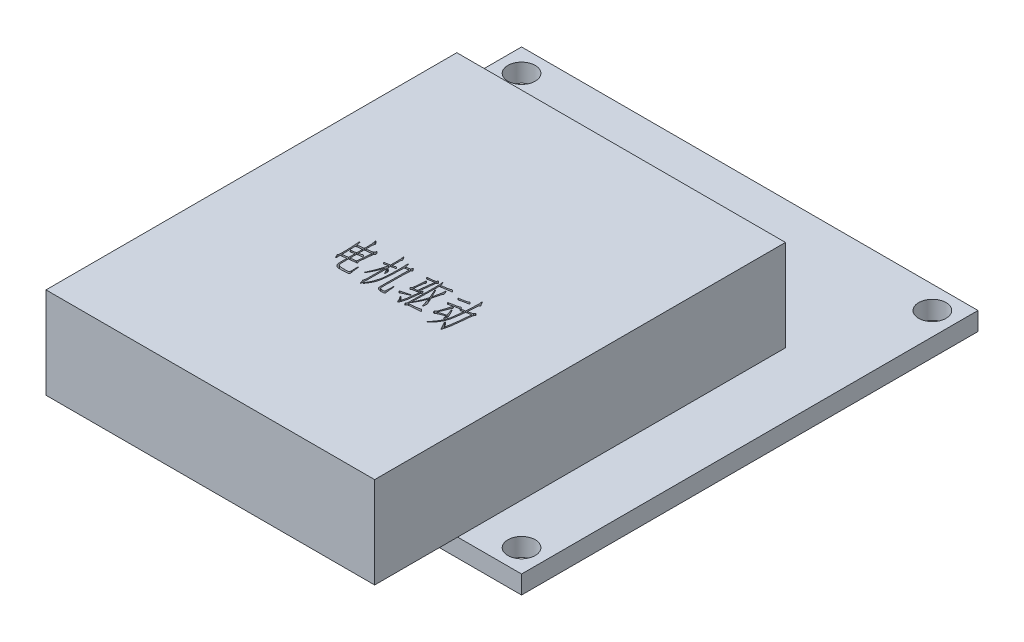
from build123d import *

# Parameters (mm, degrees)
SKETCH_1_W               = 50
SKETCH_1_H               = 50
EXTRUDE_1_DEPTH          = 2
SKETCH_2_R               = 1.5
CUT_EXTRUDE_1_DEPTH      = 36.411862419
MIRROR_2_COPY_1_SKETCH_R = 1.5
MIRROR_2_COPY_1_DEPTH    = 36.411862419
SKETCH_6_W               = 36
SKETCH_6_H               = 45
EXTRUDE_2_DEPTH          = 10
CUT_EXTRUDE_2_DEPTH      = 1


with BuildPart() as part:
    # 草图1 → 凸台-拉伸1 (new body)
    with BuildSketch(Plane(origin=(0, 0, 0), x_dir=(1, 0, 0), z_dir=(0, 1, 0))):
        Rectangle(SKETCH_1_W, SKETCH_1_H)
    extrude(amount=EXTRUDE_1_DEPTH)

    # 草图2 → 切除-拉伸1 (cut, through all)
    with BuildSketch(Plane(origin=(0, 2, 0), x_dir=(1, 0, 0), z_dir=(0, 1, 0))):
        with Locations(Location((-22.5, 22.5, 0), (0, 0, 270))):
            Circle(SKETCH_2_R)
    cut_extrude_1 = extrude(amount=-CUT_EXTRUDE_1_DEPTH, mode=Mode.SUBTRACT)

    # 镜向1: 切除-拉伸1 across plane
    add(cut_extrude_1.mirror(Plane(origin=(0, 0, 0), x_dir=(1, 0, 0), z_dir=(0, 0, -1))), mode=Mode.SUBTRACT)

    # 镜向2: 切除-拉伸1 across plane
    add(cut_extrude_1.mirror(Plane.ZY), mode=Mode.SUBTRACT)

    # 镜向2 copy 1 sketch → 镜向2 copy 1 (cut, through all)
    with BuildSketch(Plane(origin=(0, 2, 0), x_dir=(-1, 0, 0), z_dir=(0, 1, 0))):
        with Locations(Location((-22.5, 22.5, 0), (0, 0, 270))):
            Circle(MIRROR_2_COPY_1_SKETCH_R)
    extrude(amount=-MIRROR_2_COPY_1_DEPTH, mode=Mode.SUBTRACT)

    # 草图6 → 凸台-拉伸2 (add)
    with BuildSketch(Plane(origin=(0, 2, 0), x_dir=(1, 0, 0), z_dir=(0, 1, 0))):
        with Locations((0, -11.592181412)):
            Rectangle(SKETCH_6_W, SKETCH_6_H)
    extrude(amount=EXTRUDE_2_DEPTH)

    # 草图8 → 切除-拉伸2 (cut)
    # profile 1 of 8: a face of its own
    with BuildSketch(Plane(origin=(0, 12, 0), x_dir=(1, 0, 0), z_dir=(0, 1, 0))):
        with BuildLine():
            Line((-5.321410153, -12.334327445), (-5.255780492, -12.581184467))
            Line((-5.255780492, -12.581184467), (-5.200591913, -12.797464032))
            Line((-5.200591913, -12.797464032), (-5.009669262, -12.777327659))
            Line((-5.009669262, -12.777327659), (-4.606941796, -12.727359621))
            Line((-4.606941796, -12.727359621), (-4.501039388, -12.707223248))
            Line((-4.501039388, -12.707223248), (-4.495818847, -12.244086661))
            add(Edge.make_bspline(
                [(-4.495818847, -12.244086661), (-4.495796903, -12.240108766), (-4.49572831, -12.227674188), (-4.496900542, -12.202329396), (-4.497195093, -12.163532762), (-4.498981349, -12.112079423), (-4.500760435, -12.049387208), (-4.505478606, -11.977281925), (-4.512294709, -11.896734079), (-4.520841528, -11.809360911), (-4.532772756, -11.718038707), (-4.551420898, -11.626584389), (-4.576197761, -11.536498145), (-4.596664094, -11.477802544), (-4.606941796, -11.448327019)],
                knots=[0, 0, 0, 0, 0.177294891, 0.554209453, 1.130524385, 1.906506064, 2.848971625, 3.925876191, 5.126764862, 6.452083082, 7.83897123, 9.22979357, 10.608868701, 12, 12, 12, 12], degree=3))
            Line((-4.606941796, -11.448327019), (-4.561448508, -11.378222608))
            Line((-4.561448508, -11.378222608), (-4.259402908, -11.720540955))
            add(Edge.make_bspline(
                [(-4.259402908, -11.720540955), (-4.274604129, -11.755032933), (-4.304411059, -11.822665657), (-4.330859378, -11.913321098), (-4.343688812, -11.993948759), (-4.349637893, -12.069727322), (-4.354276507, -12.161495706), (-4.354657956, -12.228168285), (-4.354864233, -12.264223035)],
                knots=[0, 0, 0, 0, 1.215957117, 2.384278755, 3.034624226, 3.848266097, 4.836399765, 6, 6, 6, 6], degree=3))
            Line((-4.354864233, -12.264223035), (-4.354864233, -12.687086874))
            Line((-4.354864233, -12.687086874), (-4.108007212, -12.656509419))
            Line((-4.108007212, -12.656509419), (-3.72094137, -12.60132084))
            Line((-3.72094137, -12.60132084), (-3.624734253, -12.581184467))
            Line((-3.624734253, -12.581184467), (-3.53971401, -12.405177648))
            add(Edge.make_bspline(
                [(-3.53971401, -12.405177648), (-3.535956731, -12.396840672), (-3.529581456, -12.382694661), (-3.519121858, -12.366274684), (-3.512993854, -12.355066381), (-3.503878958, -12.350871862), (-3.495603174, -12.357146151), (-3.485215813, -12.365313769), (-3.470102925, -12.377866347), (-3.459773015, -12.388653619), (-3.453947975, -12.394736565)],
                knots=[0, 0, 0, 0, 1.663720426, 2.822966936, 3.56700533, 3.954602535, 4.461796658, 5.269494342, 6.4602669, 8, 8, 8, 8], degree=3))
            Line((-3.453947975, -12.394736565), (-3.333129735, -12.530470637))
            add(Edge.make_bspline(
                [(-3.333129735, -12.530470637), (-3.327388415, -12.538395529), (-3.316998733, -12.552736674), (-3.303506324, -12.572179731), (-3.297045347, -12.589439951), (-3.294909183, -12.6066701), (-3.29881186, -12.62314435), (-3.304391359, -12.638589405), (-3.314224578, -12.652404544), (-3.325998214, -12.67152188), (-3.343771975, -12.698973908), (-3.368199188, -12.733808825), (-3.392941987, -12.778842429), (-3.412430301, -12.835115817), (-3.428931241, -12.900722141), (-3.435533439, -12.948272485), (-3.439032143, -12.973470851)],
                knots=[0, 0, 0, 0, 0.847429402, 1.533536147, 2.036930199, 2.426382901, 3.016860564, 3.480069352, 3.837966044, 4.476237987, 5.424607541, 6.665143789, 8.156530738, 9.850434346, 11.801019622, 14, 14, 14, 14], degree=3))
            Line((-3.439032143, -12.973470851), (-3.494220722, -13.497016557))
            Line((-3.494220722, -13.497016557), (-3.559850383, -14.136905754))
            Line((-3.559850383, -14.136905754), (-3.579986756, -14.29799674))
            Line((-3.579986756, -14.29799674), (-3.483779639, -14.433730812))
            add(Edge.make_bspline(
                [(-3.483779639, -14.433730812), (-3.47723596, -14.445118634), (-3.466411258, -14.463956625), (-3.458797469, -14.490570206), (-3.46629652, -14.511585289), (-3.477933955, -14.513376533), (-3.483779639, -14.514276305)],
                knots=[0, 0, 0, 0, 1.606901506, 2.658172752, 3.325977029, 4, 4, 4, 4], degree=3))
            Line((-3.483779639, -14.514276305), (-3.564325133, -14.519496847))
            Line((-3.564325133, -14.519496847), (-4.007325346, -14.559769593))
            Line((-4.007325346, -14.559769593), (-4.259402908, -14.589601258))
            Line((-4.259402908, -14.589601258), (-4.365305316, -14.60451709))
            Line((-4.365305316, -14.60451709), (-4.365305316, -15.148199169))
            add(Edge.make_bspline(
                [(-4.365305316, -15.148199169), (-4.364374898, -15.203398108), (-4.362573971, -15.310241694), (-4.352645287, -15.440930317), (-4.336527188, -15.53740369), (-4.317567157, -15.601811104), (-4.289687683, -15.658019504), (-4.262256869, -15.702893671), (-4.22583098, -15.731868398), (-4.184462117, -15.749365796), (-4.129863102, -15.764824666), (-4.061109325, -15.77680867), (-3.978187121, -15.786271306), (-3.881355972, -15.792409436), (-3.770458369, -15.797149055), (-3.691861932, -15.797563432), (-3.650091167, -15.797783657)],
                knots=[0, 0, 0, 0, 1.931152807, 3.737957541, 4.577172512, 5.350113142, 6.073531508, 6.773090527, 7.162848559, 7.680298175, 8.332476513, 9.14602524, 10.117846342, 11.250994603, 12.539017008, 14, 14, 14, 14], degree=3))
            add(Edge.make_bspline(
                [(-3.650091167, -15.797783657), (-3.611060719, -15.79793522), (-3.537715147, -15.798220037), (-3.43499322, -15.79636997), (-3.346894327, -15.791275449), (-3.273545692, -15.78394411), (-3.214258877, -15.775275549), (-3.170222557, -15.762739196), (-3.137887349, -15.749482276), (-3.109083544, -15.712100241), (-3.096211733, -15.648600227), (-3.089605012, -15.594084763), (-3.086272714, -15.566588259)],
                knots=[0, 0, 0, 0, 1.652015129, 3.104447941, 4.3482727, 5.384821521, 6.227270062, 6.873348196, 7.334536251, 7.663266203, 8.821398446, 10, 10, 10, 10], degree=3))
            Line((-3.086272714, -15.566588259), (-3.086272714, -15.289153783))
            Line((-3.086272714, -15.289153783), (-3.086272714, -14.851374111))
            Line((-3.086272714, -14.851374111), (-3.025863594, -14.84167882))
            Line((-3.025863594, -14.84167882), (-3.016168303, -14.96249706))
            Line((-3.016168303, -14.96249706), (-2.990811389, -15.168335543))
            Line((-2.990811389, -15.168335543), (-2.955759183, -15.440549478))
            Line((-2.955759183, -15.440549478), (-2.919961186, -15.671744876))
            Line((-2.919961186, -15.671744876), (-2.895350063, -15.838056404))
            add(Edge.make_bspline(
                [(-2.895350063, -15.838056404), (-2.892722166, -15.852044917), (-2.888497794, -15.874531599), (-2.886993069, -15.904569765), (-2.900028918, -15.924424799), (-2.912739462, -15.93022324), (-2.919961186, -15.933517729)],
                knots=[0, 0, 0, 0, 1.559608042, 2.507086382, 3.151774227, 4, 4, 4, 4], degree=3))
            Line((-2.919961186, -15.933517729), (-2.960233933, -15.949179353))
            add(Edge.make_bspline(
                [(-2.960233933, -15.949179353), (-2.964924906, -15.951022164), (-2.976077787, -15.955403485), (-2.996506676, -15.960013957), (-3.022475023, -15.966317653), (-3.054702471, -15.971816832), (-3.092633808, -15.978877556), (-3.136508261, -15.985109763), (-3.186128102, -15.993000696), (-3.296984019, -16.007432576), (-3.463935903, -16.024270861), (-3.612753603, -16.024427911), (-3.685143373, -16.024504305)],
                knots=[0, 0, 0, 0, 0.206618915, 0.491240576, 0.857597671, 1.30390666, 1.832361082, 2.441372039, 3.122534554, 3.89462094, 7.030145068, 10, 10, 10, 10], degree=3))
            add(Edge.make_bspline(
                [(-3.685143373, -16.024504305), (-3.725172175, -16.024250371), (-3.801031435, -16.023769137), (-3.908490442, -16.019371753), (-4.0035546, -16.012147867), (-4.086481247, -16.001976443), (-4.157613121, -15.988929884), (-4.216643226, -15.97292479), (-4.264030664, -15.954477185), (-4.308564847, -15.924139234), (-4.349460168, -15.882669404), (-4.391231289, -15.834267524), (-4.424100492, -15.785767443), (-4.454845445, -15.717779188), (-4.478349949, -15.623181951), (-4.498078115, -15.499372006), (-4.508594065, -15.3626664), (-4.510008226, -15.267788175), (-4.510734679, -15.219049372)],
                knots=[0, 0, 0, 0, 1.375107078, 2.605988713, 3.693973982, 4.649466436, 5.475237603, 6.17560074, 6.749778481, 7.211670088, 8.015056038, 8.742243092, 9.407844955, 10.019243034, 11.295622579, 12.740386124, 14.325541172, 16, 16, 16, 16], degree=3))
            Line((-4.510734679, -15.219049372), (-4.510734679, -14.624653463))
            Line((-4.510734679, -14.624653463), (-4.662130375, -14.640315087))
            Line((-4.662130375, -14.640315087), (-5.024585094, -14.695503665))
            Line((-5.024585094, -14.695503665), (-5.155098625, -14.715640039))
            Line((-5.155098625, -14.715640039), (-5.160319166, -14.942360686))
            Line((-5.160319166, -14.942360686), (-5.165539708, -15.072874217))
            add(Edge.make_bspline(
                [(-5.165539708, -15.072874217), (-5.166270538, -15.092510449), (-5.167666987, -15.130030809), (-5.179024336, -15.167510988), (-5.189353525, -15.199324625), (-5.21002754, -15.195417564), (-5.222118977, -15.173064914), (-5.230412098, -15.155074397), (-5.235644118, -15.14372442)],
                knots=[0, 0, 0, 0, 1.721263003, 3.288940973, 3.839377096, 4.198736227, 4.863606649, 6, 6, 6, 6], degree=3))
            Line((-5.235644118, -15.14372442), (-5.311714862, -14.972192351))
            Line((-5.311714862, -14.972192351), (-5.3616829, -14.861815193))
            add(Edge.make_bspline(
                [(-5.3616829, -14.861815193), (-5.366586864, -14.850448101), (-5.37437425, -14.832397413), (-5.386870516, -14.809609782), (-5.381553267, -14.789074884), (-5.374181548, -14.764273197), (-5.359455324, -14.728404529), (-5.348009196, -14.700703201), (-5.341546526, -14.685062583)],
                knots=[0, 0, 0, 0, 1.195724136, 1.898783123, 2.330290027, 3.145663464, 4.388395428, 6, 6, 6, 6], degree=3))
            add(Edge.make_bspline(
                [(-5.341546526, -14.685062583), (-5.337529824, -14.67571121), (-5.328958458, -14.655756024), (-5.321412175, -14.621187715), (-5.315104143, -14.581376491), (-5.313519352, -14.521712907), (-5.311816917, -14.448655188), (-5.30988406, -14.368832818), (-5.307131625, -14.304724576), (-5.306679408, -14.267669608), (-5.306494321, -14.252503452)],
                knots=[0, 0, 0, 0, 0.558699634, 1.192226558, 1.938775613, 2.774002823, 4.470288396, 5.961506424, 7.165668957, 8, 8, 8, 8], degree=3))
            Line((-5.306494321, -14.252503452), (-5.311714862, -13.8751329))
            Line((-5.311714862, -13.8751329), (-5.326630694, -13.401555232))
            add(Edge.make_bspline(
                [(-5.326630694, -13.401555232), (-5.326586994, -13.3955882), (-5.326483178, -13.381412732), (-5.32756563, -13.357309249), (-5.328015273, -13.32721381), (-5.329635225, -13.291414536), (-5.332063327, -13.249424797), (-5.334217736, -13.201439833), (-5.336280118, -13.147475589), (-5.340311654, -13.07092063), (-5.345001615, -12.97993476), (-5.349741709, -12.882686368), (-5.355507094, -12.804941924), (-5.359109986, -12.739229704), (-5.365472687, -12.672175031), (-5.37234789, -12.589537284), (-5.384374429, -12.484760707), (-5.392350137, -12.407423921), (-5.396735105, -12.364904901)],
                knots=[0, 0, 0, 0, 0.275532466, 0.654563513, 1.113927774, 1.665470852, 2.30930182, 3.056329963, 3.883644582, 4.803233469, 6.596547928, 8.091177521, 9.299307877, 10.196626331, 11.130014446, 12.409513054, 14.025984863, 16, 16, 16, 16], degree=3))
            Line((-5.396735105, -12.364904901), (-5.321410153, -12.334327445))
        make_face()
        with BuildLine():
            Line((-5.155098625, -14.509055764), (-4.510734679, -14.433730812))
            Line((-4.510734679, -14.433730812), (-4.506259929, -13.734178287))
            Line((-4.506259929, -13.734178287), (-4.641994001, -13.764009951))
            Line((-4.641994001, -13.764009951), (-4.797864447, -13.804282698))
            Line((-4.797864447, -13.804282698), (-4.93881906, -13.854996527))
            Line((-4.93881906, -13.854996527), (-4.973871265, -13.804282698))
            Line((-4.973871265, -13.804282698), (-5.0596373, -13.693905541))
            add(Edge.make_bspline(
                [(-5.0596373, -13.693905541), (-5.064878313, -13.68811985), (-5.073884939, -13.6781772), (-5.079991984, -13.659186487), (-5.070697443, -13.643218857), (-5.060059415, -13.639789945), (-5.054416758, -13.63797117)],
                knots=[0, 0, 0, 0, 1.284117706, 2.206742812, 3.048814964, 4, 4, 4, 4], degree=3))
            Line((-5.054416758, -13.63797117), (-4.87840994, -13.613360047))
            Line((-4.87840994, -13.613360047), (-4.671825665, -13.588003133))
            Line((-4.671825665, -13.588003133), (-4.506259929, -13.557425677))
            Line((-4.506259929, -13.557425677), (-4.501039388, -12.90336644))
            Line((-4.501039388, -12.90336644), (-4.651689292, -12.928723354))
            Line((-4.651689292, -12.928723354), (-4.989532889, -12.973470851))
            Line((-4.989532889, -12.973470851), (-5.195371372, -13.009268848))
            Line((-5.195371372, -13.009268848), (-5.185676081, -13.401555232))
            Line((-5.185676081, -13.401555232), (-5.155098625, -14.509055764))
        make_face(mode=Mode.SUBTRACT)
        with BuildLine():
            Line((-4.365305316, -14.413594439), (-4.002850596, -14.373321692))
            Line((-4.002850596, -14.373321692), (-3.831318527, -14.342744236))
            Line((-3.831318527, -14.342744236), (-3.73063666, -14.322607863))
            Line((-3.73063666, -14.322607863), (-3.705279746, -14.080971383))
            Line((-3.705279746, -14.080971383), (-3.665006999, -13.673769167))
            Line((-3.665006999, -13.673769167), (-3.615038962, -13.059236885))
            Line((-3.615038962, -13.059236885), (-3.589682047, -12.792243491))
            Line((-3.589682047, -12.792243491), (-3.826097986, -12.817600405))
            Line((-3.826097986, -12.817600405), (-4.360084775, -12.888450608))
            Line((-4.360084775, -12.888450608), (-4.365305316, -13.527594013))
            add(Edge.make_bspline(
                [(-4.365305316, -13.527594013), (-4.317432654, -13.516173791), (-4.228388545, -13.494931949), (-4.106876802, -13.458076835), (-4.005804215, -13.423224044), (-3.948181529, -13.394374311), (-3.922305103, -13.381418858)],
                knots=[0, 0, 0, 0, 1.262396956, 2.348083582, 3.25817942, 4, 4, 4, 4], degree=3))
            Line((-3.922305103, -13.381418858), (-3.785825239, -13.547730386))
            add(Edge.make_bspline(
                [(-3.785825239, -13.547730386), (-3.779232862, -13.558053053), (-3.767886654, -13.575819501), (-3.760425671, -13.602950003), (-3.770160326, -13.625628999), (-3.783854301, -13.62736448), (-3.79104578, -13.628275879)],
                knots=[0, 0, 0, 0, 1.442479735, 2.482666664, 3.203162602, 4, 4, 4, 4], degree=3))
            Line((-3.79104578, -13.628275879), (-3.861895983, -13.633496421))
            Line((-3.861895983, -13.633496421), (-4.027461719, -13.653632794))
            Line((-4.027461719, -13.653632794), (-4.188552706, -13.673769167))
            Line((-4.188552706, -13.673769167), (-4.365305316, -13.708821373))
            Line((-4.365305316, -13.708821373), (-4.365305316, -14.413594439))
        make_face(mode=Mode.SUBTRACT)
    # profile 2 of 8: a face of its own
    with BuildSketch(Plane(origin=(0, 12, 0), x_dir=(1, 0, 0), z_dir=(0, 1, 0))):
        with BuildLine():
            Line((-1.306068154, -16.054335969), (-1.261320658, -15.979011017))
            Line((-1.261320658, -15.979011017), (-1.195690997, -15.87832915))
            add(Edge.make_bspline(
                [(-1.195690997, -15.87832915), (-1.184621914, -15.860757327), (-1.159663628, -15.82113683), (-1.121315998, -15.752970845), (-1.07659256, -15.670292199), (-1.02676493, -15.573226967), (-0.974440962, -15.462091515), (-0.924448316, -15.337176124), (-0.875740607, -15.199825663), (-0.83020517, -15.053091676), (-0.787841914, -14.903659328), (-0.750809474, -14.758071145), (-0.721711649, -14.619185541), (-0.691612297, -14.440897641), (-0.66535467, -14.215536467), (-0.648525053, -13.988672438), (-0.640439268, -13.809745838), (-0.634222159, -13.688952111), (-0.629600802, -13.583050843), (-0.627586301, -13.517652271), (-0.626652002, -13.487321266)],
                knots=[0, 0, 0, 0, 0.450396065, 1.015541542, 1.69591192, 2.489306403, 3.381862471, 4.359132752, 5.406289086, 6.54209713, 7.690873604, 8.775026693, 9.799772289, 10.767790753, 12.695987523, 14.718287292, 15.700853826, 16.580828697, 17.341806847, 18, 18, 18, 18], degree=3))
            Line((-0.626652002, -13.487321266), (-0.621431461, -13.09428909))
            add(Edge.make_bspline(
                [(-0.621431461, -13.09428909), (-0.620621398, -13.05849225), (-0.619074475, -12.9901335), (-0.617868642, -12.892425292), (-0.616129096, -12.804181332), (-0.615293144, -12.725372159), (-0.615577689, -12.6557641), (-0.615216225, -12.595599663), (-0.616154697, -12.544887981), (-0.616708893, -12.514311718), (-0.616956712, -12.500638973)],
                knots=[0, 0, 0, 0, 1.447396349, 2.76399273, 3.949966632, 5.015227426, 5.949801441, 6.763785261, 7.447203589, 8, 8, 8, 8], degree=3))
            Line((-0.616956712, -12.500638973), (-0.641567835, -11.785424825))
            Line((-0.641567835, -11.785424825), (-0.576683965, -11.775729534))
            Line((-0.576683965, -11.775729534), (-0.465561016, -12.228425038))
            Line((-0.465561016, -12.228425038), (-0.194092872, -12.183677541))
            Line((-0.194092872, -12.183677541), (-0.017340262, -12.143404795))
            Line((-0.017340262, -12.143404795), (0.05798469, -11.992009099))
            add(Edge.make_bspline(
                [(0.05798469, -11.992009099), (0.063298397, -11.98199485), (0.072481124, -11.964689017), (0.083080752, -11.940688002), (0.091196213, -11.929522977), (0.094395741, -11.91785689), (0.103055291, -11.924118323), (0.110058234, -11.934836684), (0.125918376, -11.953354954), (0.137204987, -11.968379621), (0.143750725, -11.977093267)],
                knots=[0, 0, 0, 0, 1.750642571, 3.025322233, 3.841294237, 4.147689096, 4.402625028, 5.10337688, 6.320085901, 8, 8, 8, 8], degree=3))
            Line((0.143750725, -11.977093267), (0.259348424, -12.147879544))
            Line((0.259348424, -12.147879544), (0.294400629, -12.198593373))
            add(Edge.make_bspline(
                [(0.294400629, -12.198593373), (0.293574976, -12.201657379), (0.291535165, -12.20922714), (0.282109637, -12.220416748), (0.267615088, -12.233748582), (0.25570651, -12.243177816), (0.248907341, -12.248561411)],
                knots=[0, 0, 0, 0, 0.548465928, 1.355009271, 2.489850087, 4, 4, 4, 4], degree=3))
            add(Edge.make_bspline(
                [(0.248907341, -12.248561411), (0.240375263, -12.256719069), (0.223003126, -12.27332885), (0.202476091, -12.304647821), (0.188760255, -12.341674939), (0.179328575, -12.386627465), (0.174413718, -12.445410227), (0.168212174, -12.52443608), (0.162515777, -12.62663862), (0.158218938, -12.728826206), (0.155399799, -12.829526405), (0.153459422, -12.927983529), (0.149968658, -13.046294309), (0.148185735, -13.184778598), (0.145781328, -13.342883262), (0.143870953, -13.521135587), (0.140370039, -13.719005603), (0.139162216, -13.85772963), (0.138530184, -13.930321479)],
                knots=[0, 0, 0, 0, 0.332112915, 0.676214057, 1.044588446, 1.439171756, 1.967855015, 2.705969595, 3.674883544, 4.853475679, 5.589757507, 6.515230302, 7.630069172, 8.926968948, 10.420108045, 12.088465276, 13.953162509, 16, 16, 16, 16], degree=3))
            Line((0.138530184, -13.930321479), (0.133309643, -14.468783018))
            add(Edge.make_bspline(
                [(0.133309643, -14.468783018), (0.132495333, -14.508308905), (0.130917996, -14.584871519), (0.129748132, -14.696003082), (0.127897028, -14.799412384), (0.127464105, -14.89562557), (0.126460359, -14.984371268), (0.126414941, -15.065916098), (0.127330389, -15.1397471), (0.127845326, -15.186483118), (0.128089101, -15.208608289)],
                knots=[0, 0, 0, 0, 1.282389524, 2.484020003, 3.605019191, 4.637230873, 5.604933393, 6.48389933, 7.282266915, 8, 8, 8, 8], degree=3))
            add(Edge.make_bspline(
                [(0.128089101, -15.208608289), (0.128341894, -15.238934997), (0.128847504, -15.299591467), (0.129510158, -15.387917201), (0.134166367, -15.468519654), (0.139079511, -15.528995981), (0.150530772, -15.571073822), (0.168094523, -15.597976125), (0.192697442, -15.621951945), (0.224780326, -15.644336306), (0.267306874, -15.661742111), (0.319976656, -15.676734698), (0.38412373, -15.686391118), (0.430605796, -15.689966853), (0.455491616, -15.691881249)],
                knots=[0, 0, 0, 0, 1.548227621, 3.096611253, 4.507253594, 5.670446461, 6.188252976, 6.712856766, 7.287138982, 7.934824603, 8.696328188, 9.620171516, 10.725874525, 12, 12, 12, 12], degree=3))
            add(Edge.make_bspline(
                [(0.455491616, -15.691881249), (0.482344028, -15.694324692), (0.529778126, -15.698640972), (0.591365258, -15.698718962), (0.636047874, -15.692901979), (0.671108378, -15.667929421), (0.68476983, -15.617461485), (0.689351808, -15.57810149), (0.691907554, -15.556147177)],
                knots=[0, 0, 0, 0, 1.45354194, 2.56764457, 3.336336834, 3.835662206, 4.792770472, 6, 6, 6, 6], degree=3))
            Line((0.691907554, -15.556147177), (0.702348637, -15.294374324))
            Line((0.702348637, -15.294374324), (0.717264469, -14.821542447))
            Line((0.717264469, -14.821542447), (0.72248501, -14.730555871))
            Line((0.72248501, -14.730555871), (0.777673589, -14.730555871))
            Line((0.777673589, -14.730555871), (0.788114671, -14.831237737))
            Line((0.788114671, -14.831237737), (0.808251045, -15.087790049))
            Line((0.808251045, -15.087790049), (0.84330325, -15.3853609))
            Line((0.84330325, -15.3853609), (0.878355455, -15.651608502))
            add(Edge.make_bspline(
                [(0.878355455, -15.651608502), (0.880505955, -15.670076121), (0.884458869, -15.704022148), (0.894346054, -15.748691929), (0.906031932, -15.781913419), (0.904351375, -15.800976362), (0.90371237, -15.808224739)],
                knots=[0, 0, 0, 0, 1.398542196, 2.570713209, 3.45653668, 4, 4, 4, 4], degree=3))
            add(Edge.make_bspline(
                [(0.90371237, -15.808224739), (0.899739346, -15.816300866), (0.891125867, -15.833809835), (0.864861517, -15.854397316), (0.828054818, -15.868816121), (0.78105477, -15.881681882), (0.722970036, -15.889836335), (0.653724302, -15.89487112), (0.573556886, -15.896161717), (0.516392769, -15.894255937), (0.486069071, -15.893244982)],
                knots=[0, 0, 0, 0, 0.481460529, 1.043801962, 1.747490212, 2.610949425, 3.670894661, 4.910120447, 6.36091974, 8, 8, 8, 8], degree=3))
            add(Edge.make_bspline(
                [(0.486069071, -15.893244982), (0.453957761, -15.891576926), (0.392412262, -15.888379879), (0.304115579, -15.874688367), (0.225024233, -15.851125727), (0.153504745, -15.822030111), (0.093897093, -15.779352584), (0.046361117, -15.72502028), (0.015148903, -15.65708104), (-0.007479577, -15.553651393), (-0.017984397, -15.419665296), (-0.017551981, -15.312024866), (-0.017340262, -15.259322118)],
                knots=[0, 0, 0, 0, 1.004787696, 1.925806212, 2.783943376, 3.580792567, 4.326890195, 5.054220735, 5.811881477, 6.635445581, 8.352651878, 10, 10, 10, 10], degree=3))
            Line((-0.017340262, -15.259322118), (-0.012865512, -14.594821799))
            Line((-0.012865512, -14.594821799), (0.012491403, -12.319411613))
            Line((0.012491403, -12.319411613), (-0.455865725, -12.405177648))
            add(Edge.make_bspline(
                [(-0.455865725, -12.405177648), (-0.457327468, -12.428547187), (-0.460048633, -12.472051662), (-0.464256767, -12.532423601), (-0.465866336, -12.582946503), (-0.46887605, -12.627894082), (-0.470233762, -12.676393535), (-0.471577952, -12.738053694), (-0.474068496, -12.817344307), (-0.476863547, -12.950105806), (-0.481034707, -13.13682425), (-0.487359962, -13.33494264), (-0.493334226, -13.50696189), (-0.498030106, -13.650199375), (-0.506349976, -13.805263492), (-0.512043761, -13.942572958), (-0.519921273, -14.060151342), (-0.527958148, -14.156417973), (-0.539520656, -14.259288461), (-0.5527335, -14.36898754), (-0.569161354, -14.485102422), (-0.588927419, -14.607820526), (-0.610462652, -14.737400395), (-0.634187912, -14.873322574), (-0.664911109, -15.013680227), (-0.706823327, -15.156273858), (-0.760244918, -15.300617266), (-0.824426777, -15.446837291), (-0.900192707, -15.594425557), (-0.986067979, -15.743901348), (-1.083318693, -15.894700771), (-1.154256665, -15.993965894), (-1.190470455, -16.044640678)],
                knots=[0, 0, 0, 0, 0.556766377, 1.036470108, 1.438810268, 1.75849741, 2.107447749, 2.592295321, 3.225022722, 3.993659562, 5.749719254, 7.665800851, 8.706744263, 9.842413613, 11.073325319, 12.398988745, 13.10988535, 13.875173787, 14.695698795, 15.571108291, 16.502351507, 17.483865213, 18.526569343, 19.625732515, 20.764397609, 21.940927665, 23.156500752, 24.421679417, 25.735535166, 27.099239022, 28.519163328, 30, 30, 30, 30], degree=3))
            Line((-1.190470455, -16.044640678), (-1.256100117, -16.134881462))
            Line((-1.256100117, -16.134881462), (-1.306068154, -16.054335969))
        make_face()
    # profile 3 of 8: a face of its own
    with BuildSketch(Plane(origin=(0, 12, 0), x_dir=(1, 0, 0), z_dir=(0, 1, 0))):
        with BuildLine():
            Line((-2.222646036, -14.972192351), (-2.182373289, -14.891646857))
            add(Edge.make_bspline(
                [(-2.182373289, -14.891646857), (-2.167972688, -14.861060794), (-2.140450886, -14.802606044), (-2.100849976, -14.719230376), (-2.065489883, -14.643793665), (-2.035419575, -14.576078811), (-2.008231075, -14.516819329), (-1.984938875, -14.465541949), (-1.966490525, -14.421941613), (-1.951085618, -14.383551441), (-1.935911447, -14.345614443), (-1.919772982, -14.302159066), (-1.900016032, -14.251429211), (-1.878505316, -14.192461149), (-1.854927637, -14.125397035), (-1.827863697, -14.050646013), (-1.798112591, -13.968171829), (-1.754528091, -13.846070701), (-1.699865958, -13.683381839), (-1.640023588, -13.477935223), (-1.582837192, -13.262488536), (-1.549691817, -13.114546116), (-1.532788802, -13.039100512)],
                knots=[0, 0, 0, 0, 1.030703704, 1.969836002, 2.814173433, 3.570663832, 4.228669159, 4.801998382, 5.287666534, 5.671901349, 6.063173338, 6.53333551, 7.085118219, 7.722952876, 8.446926576, 9.252476561, 10.14673978, 11.120025788, 13.205233894, 15.378080529, 17.642978206, 20, 20, 20, 20], degree=3))
            add(Edge.make_bspline(
                [(-1.532788802, -13.039100512), (-1.558654603, -13.044765911), (-1.608200916, -13.055618065), (-1.679060715, -13.072005005), (-1.743436742, -13.087732657), (-1.801389938, -13.102541301), (-1.85292919, -13.116493028), (-1.897701369, -13.130406653), (-1.93667686, -13.14154418), (-1.959930213, -13.150569283), (-1.970568474, -13.15469821)],
                knots=[0, 0, 0, 0, 1.402469967, 2.686451399, 3.852096233, 4.91235732, 5.854704873, 6.679518484, 7.395888129, 8, 8, 8, 8], degree=3))
            Line((-1.970568474, -13.15469821), (-2.101827796, -13.02418468))
            add(Edge.make_bspline(
                [(-2.101827796, -13.02418468), (-2.108423087, -13.018410877), (-2.119515897, -13.008699752), (-2.131207043, -12.992929431), (-2.127516861, -12.979927346), (-2.11672265, -12.973886004), (-2.101578478, -12.967887934), (-2.088997349, -12.965286326), (-2.081691423, -12.96377556)],
                knots=[0, 0, 0, 0, 1.574165917, 2.647635009, 3.103278432, 3.757919303, 4.698012364, 6, 6, 6, 6], degree=3))
            Line((-2.081691423, -12.96377556), (-1.840054943, -12.928723354))
            Line((-1.840054943, -12.928723354), (-1.643911751, -12.892925357))
            Line((-1.643911751, -12.892925357), (-1.487295514, -12.868314234))
            Line((-1.487295514, -12.868314234), (-1.487295514, -12.123268421))
            add(Edge.make_bspline(
                [(-1.487295514, -12.123268421), (-1.487423465, -12.081254906), (-1.487658948, -12.003932835), (-1.489717732, -11.895012236), (-1.494168781, -11.796748205), (-1.500751872, -11.71637328), (-1.510225491, -11.646683747), (-1.518470151, -11.583298952), (-1.53293368, -11.509503041), (-1.542554467, -11.456541722), (-1.547704634, -11.428190646)],
                knots=[0, 0, 0, 0, 1.441980529, 2.65383462, 3.73864278, 4.817799107, 5.419974992, 6.152410461, 7.010954554, 8, 8, 8, 8], degree=3))
            Line((-1.547704634, -11.428190646), (-1.502957138, -11.387917899))
            Line((-1.502957138, -11.387917899), (-1.271015949, -11.720540955))
            add(Edge.make_bspline(
                [(-1.271015949, -11.720540955), (-1.280399092, -11.740838512), (-1.297937176, -11.778776785), (-1.320893244, -11.83595761), (-1.336096742, -11.898046385), (-1.341529416, -11.956833493), (-1.34461842, -12.012858013), (-1.344493558, -12.063618748), (-1.34690006, -12.121264593), (-1.346534693, -12.162046606), (-1.346340901, -12.183677541)],
                knots=[0, 0, 0, 0, 1.129488372, 2.111132768, 3.106887357, 4.345033186, 5.086752704, 5.94060522, 6.907689153, 8, 8, 8, 8], degree=3))
            Line((-1.346340901, -12.183677541), (-1.351561442, -12.837736779))
            add(Edge.make_bspline(
                [(-1.351561442, -12.837736779), (-1.317904949, -12.829128909), (-1.251871441, -12.812240405), (-1.155979157, -12.781470312), (-1.065358837, -12.746784571), (-1.00761995, -12.720207541), (-0.979411431, -12.707223248)],
                knots=[0, 0, 0, 0, 1.054966239, 2.069827124, 3.057007872, 4, 4, 4, 4], degree=3))
            Line((-0.979411431, -12.707223248), (-0.848152109, -12.852652611))
            add(Edge.make_bspline(
                [(-0.848152109, -12.852652611), (-0.842488388, -12.862191268), (-0.833744009, -12.876918271), (-0.817939345, -12.894234357), (-0.823071756, -12.905124416), (-0.833590951, -12.907696945), (-0.848275628, -12.911756914), (-0.860985665, -12.912585595), (-0.868288482, -12.913061731)],
                knots=[0, 0, 0, 0, 1.981905509, 3.059919989, 3.343564363, 3.854474294, 4.767243278, 6, 6, 6, 6], degree=3))
            Line((-0.868288482, -12.913061731), (-1.144977168, -12.96377556))
            Line((-1.144977168, -12.96377556), (-1.346340901, -13.004048306))
            Line((-1.346340901, -13.004048306), (-1.346340901, -13.260600618))
            Line((-1.346340901, -13.260600618), (-1.205386288, -13.39633469))
            Line((-1.205386288, -13.39633469), (-1.100229671, -13.497016557))
            Line((-1.100229671, -13.497016557), (-1.019684178, -13.57756205))
            add(Edge.make_bspline(
                [(-1.019684178, -13.57756205), (-1.008878107, -13.588570291), (-0.991615839, -13.606155519), (-0.974466747, -13.630876235), (-0.970452923, -13.652039775), (-0.96887464, -13.674763183), (-0.965362662, -13.706274478), (-0.964326135, -13.730438144), (-0.963749808, -13.743873578)],
                knots=[0, 0, 0, 0, 1.523204729, 2.433259024, 2.884160726, 3.621426984, 4.677470549, 6, 6, 6, 6], degree=3))
            Line((-0.963749808, -13.743873578), (-0.97419089, -13.965373685))
            add(Edge.make_bspline(
                [(-0.97419089, -13.965373685), (-0.974434993, -13.974311421), (-0.974869363, -13.990215753), (-0.975499897, -14.011384028), (-0.979257052, -14.026142276), (-0.983629098, -14.037228876), (-0.996157732, -14.042599879), (-1.00120087, -14.035163867), (-1.004022554, -14.031003346)],
                knots=[0, 0, 0, 0, 1.677002643, 2.984156978, 3.944128222, 4.527591577, 5.176173178, 6, 6, 6, 6], degree=3))
            Line((-1.004022554, -14.031003346), (-1.044295301, -13.950457852))
            Line((-1.044295301, -13.950457852), (-1.104704421, -13.829639613))
            add(Edge.make_bspline(
                [(-1.104704421, -13.829639613), (-1.125565544, -13.791096377), (-1.166286867, -13.715859223), (-1.226500688, -13.60544008), (-1.286995804, -13.50173606), (-1.326914825, -13.434348511), (-1.346340901, -13.401555232)],
                knots=[0, 0, 0, 0, 1.069763083, 2.088198605, 3.069646585, 4, 4, 4, 4], degree=3))
            Line((-1.346340901, -13.401555232), (-1.356781983, -15.631472129))
            Line((-1.356781983, -15.631472129), (-1.366477274, -16.039420137))
            add(Edge.make_bspline(
                [(-1.366477274, -16.039420137), (-1.367690803, -16.066843354), (-1.369791408, -16.114312608), (-1.372830067, -16.177268665), (-1.37993124, -16.213945259), (-1.384617106, -16.24168989), (-1.403286789, -16.242997317), (-1.41350188, -16.223401), (-1.429093237, -16.198199415), (-1.437555925, -16.174322964), (-1.442548018, -16.160238377)],
                knots=[0, 0, 0, 0, 2.16266419, 3.743545244, 4.80908418, 5.322941257, 5.576717178, 6.045465741, 6.847030983, 8, 8, 8, 8], degree=3))
            Line((-1.442548018, -16.160238377), (-1.538009343, -15.918601897))
            add(Edge.make_bspline(
                [(-1.538009343, -15.918601897), (-1.543422892, -15.905002246), (-1.552994729, -15.880956353), (-1.563163294, -15.848554378), (-1.57031689, -15.82569773), (-1.574804742, -15.804088614), (-1.565996166, -15.777442739), (-1.55024214, -15.743956511), (-1.530793393, -15.707082288), (-1.518339703, -15.66470369), (-1.512172842, -15.612972172), (-1.508093112, -15.549199178), (-1.5035566, -15.480774276), (-1.499545137, -15.435571794), (-1.497736597, -15.415192564)],
                knots=[0, 0, 0, 0, 1.012562945, 1.790338711, 2.345528679, 2.676361519, 3.293857606, 4.217663353, 5.263990019, 6.161813593, 7.256362729, 8.860411071, 10.584537758, 12, 12, 12, 12], degree=3))
            Line((-1.497736597, -15.415192564), (-1.487295514, -13.472405434))
            add(Edge.make_bspline(
                [(-1.487295514, -13.472405434), (-1.517368035, -13.565051917), (-1.575362317, -13.743718891), (-1.667200814, -13.998890479), (-1.761926954, -14.230464084), (-1.843260176, -14.407476642), (-1.908172218, -14.535031282), (-1.950128062, -14.620966058), (-1.99105259, -14.697060562), (-2.026040211, -14.766123553), (-2.059556062, -14.825386812), (-2.087302313, -14.877610881), (-2.113397897, -14.920214417), (-2.129645294, -14.945857888), (-2.136880002, -14.957276519)],
                knots=[0, 0, 0, 0, 2.158156981, 4.16196457, 6.007247646, 7.700356929, 8.476310978, 9.178364641, 9.818953069, 10.390534321, 10.893443202, 11.327334904, 11.700472905, 12, 12, 12, 12], degree=3))
            Line((-2.136880002, -14.957276519), (-2.171932207, -15.017685639))
            Line((-2.171932207, -15.017685639), (-2.222646036, -14.972192351))
        make_face()
    # profile 4 of 8: a face of its own
    with BuildSketch(Plane(origin=(0, 12, 0), x_dir=(1, 0, 0), z_dir=(0, 1, 0))):
        with BuildLine():
            Line((3.070982773, -12.767632368), (3.070982773, -12.449925144))
            add(Edge.make_bspline(
                [(3.070982773, -12.449925144), (3.070135316, -12.416864257), (3.068580649, -12.356213739), (3.067866165, -12.274143251), (3.064970139, -12.209293795), (3.063887128, -12.157548645), (3.061005448, -12.11009671), (3.05879341, -12.058763822), (3.051753338, -11.999495629), (3.043662462, -11.912682211), (3.03289514, -11.808548819), (3.024725821, -11.727006029), (3.021014735, -11.689963499)],
                knots=[0, 0, 0, 0, 1.301914054, 2.388373909, 3.230510913, 3.857142305, 4.425508698, 5.101899729, 5.878974422, 6.773876056, 8.534465223, 10, 10, 10, 10], degree=3))
            Line((3.021014735, -11.689963499), (3.066508023, -11.660131835))
            Line((3.066508023, -11.660131835), (3.207462636, -12.062859301))
            Line((3.207462636, -12.062859301), (3.766060548, -11.977093267))
            add(Edge.make_bspline(
                [(3.766060548, -11.977093267), (3.806968042, -11.970295476), (3.890249779, -11.956456158), (4.014988863, -11.922741251), (4.142223211, -11.87944019), (4.226420063, -11.843879658), (4.269469881, -11.825697571)],
                knots=[0, 0, 0, 0, 0.943300052, 1.92042237, 2.936712742, 4, 4, 4, 4], degree=3))
            Line((4.269469881, -11.825697571), (4.435781409, -11.986788558))
            add(Edge.make_bspline(
                [(4.435781409, -11.986788558), (4.44112443, -11.994403595), (4.450670382, -12.00800878), (4.455522252, -12.030658996), (4.445700399, -12.050639045), (4.432489944, -12.051793446), (4.425340327, -12.052418219)],
                knots=[0, 0, 0, 0, 1.280631117, 2.288002419, 3.07345148, 4, 4, 4, 4], degree=3))
            Line((4.425340327, -12.052418219), (4.299301545, -12.067334051))
            Line((4.299301545, -12.067334051), (3.952508449, -12.11804788))
            Line((3.952508449, -12.11804788), (3.640021767, -12.163541168))
            Line((3.640021767, -12.163541168), (3.34841725, -12.208288664))
            Line((3.34841725, -12.208288664), (3.207462636, -12.233645579))
            Line((3.207462636, -12.233645579), (3.187326263, -13.567866759))
            Line((3.187326263, -13.567866759), (3.16718989, -15.228744663))
            add(Edge.make_bspline(
                [(3.16718989, -15.228744663), (3.191760272, -15.187732577), (3.244395146, -15.099876153), (3.318532868, -14.953734194), (3.39769375, -14.787162508), (3.478929875, -14.602896511), (3.5577164, -14.407132637), (3.628685883, -14.206901229), (3.693306711, -14.006548253), (3.728415528, -13.871587275), (3.745924175, -13.804282698)],
                knots=[0, 0, 0, 0, 0.743673012, 1.593102408, 2.548154268, 3.613260376, 4.725860682, 5.830627269, 6.918141267, 8, 8, 8, 8], degree=3))
            add(Edge.make_bspline(
                [(3.745924175, -13.804282698), (3.725254782, -13.751245815), (3.682892021, -13.642544569), (3.615526703, -13.481592039), (3.549459893, -13.325586193), (3.496021966, -13.20361326), (3.455927889, -13.115616717), (3.429402907, -13.057170185), (3.40357139, -13.005177893), (3.374902112, -12.944557417), (3.34375251, -12.878141402), (3.322393959, -12.826375262), (3.312619253, -12.802684573)],
                knots=[0, 0, 0, 0, 1.564351938, 3.206202851, 4.795011298, 6.220600821, 6.865771509, 7.452711128, 7.984400744, 8.46114463, 9.295745364, 10, 10, 10, 10], degree=3))
            Line((3.312619253, -12.802684573), (3.363333082, -12.762411826))
            add(Edge.make_bspline(
                [(3.363333082, -12.762411826), (3.377298938, -12.787246898), (3.406698324, -12.83952696), (3.452069843, -12.922379461), (3.501426181, -13.013164864), (3.553413468, -13.112606261), (3.60932229, -13.219636337), (3.668445364, -13.335010929), (3.730917249, -13.458653208), (3.773784819, -13.543992494), (3.795892212, -13.588003133)],
                knots=[0, 0, 0, 0, 0.733592741, 1.544278812, 2.432100989, 3.394094091, 4.433306672, 5.541135379, 6.731929832, 8, 8, 8, 8], degree=3))
            add(Edge.make_bspline(
                [(3.795892212, -13.588003133), (3.809280321, -13.538836157), (3.835056671, -13.444174154), (3.868730407, -13.307146762), (3.89951015, -13.181966914), (3.926288089, -13.068285939), (3.946449657, -12.965598896), (3.964522577, -12.874590299), (3.976077228, -12.794610012), (3.984839308, -12.725250015), (3.989288118, -12.664416598), (3.995069669, -12.611065879), (3.998715603, -12.563797748), (4.001281737, -12.522731329), (4.004994344, -12.48801171), (4.005733767, -12.459595699), (4.00799319, -12.437771876), (4.00778454, -12.425317233), (4.007697028, -12.42009348)],
                knots=[0, 0, 0, 0, 2.055323953, 3.957149727, 5.691194632, 7.255244391, 8.667222266, 9.912115268, 10.99697639, 11.926068102, 12.731325317, 13.456702356, 14.090415137, 14.643378868, 15.116370485, 15.497939164, 15.789424553, 16, 16, 16, 16], degree=3))
            Line((4.007697028, -12.42009348), (4.007697028, -12.329106904))
            Line((4.007697028, -12.329106904), (4.047969775, -12.29927524))
            Line((4.047969775, -12.29927524), (4.234417676, -12.687086874))
            add(Edge.make_bspline(
                [(4.234417676, -12.687086874), (4.223615679, -12.701421659), (4.203435878, -12.728201254), (4.176864444, -12.766872409), (4.157125731, -12.802088457), (4.140134645, -12.842046484), (4.126950891, -12.885855771), (4.113465799, -12.922485192), (4.10623268, -12.948819087), (4.101241435, -12.969081175), (4.093316602, -12.995676263), (4.085562635, -13.029420993), (4.075779911, -13.069420488), (4.064671933, -13.1162382), (4.050871027, -13.169473559), (4.032385789, -13.251352291), (4.004617301, -13.360762122), (3.970947392, -13.499020043), (3.932543015, -13.644298866), (3.905810771, -13.743635756), (3.892099329, -13.794587407)],
                knots=[0, 0, 0, 0, 0.830886041, 1.552223714, 2.17034046, 2.696191633, 3.558673181, 4.286499232, 4.501485298, 4.822472265, 5.252444398, 5.785549034, 6.424731988, 7.158808698, 8.012880859, 8.970324894, 11.044118321, 13.237913295, 15.557441365, 18, 18, 18, 18], degree=3))
            Line((3.892099329, -13.794587407), (3.947287908, -13.919880397))
            Line((3.947287908, -13.919880397), (4.053190316, -14.161516877))
            Line((4.053190316, -14.161516877), (4.138210559, -14.347964778))
            Line((4.138210559, -14.347964778), (4.20384022, -14.499360473))
            add(Edge.make_bspline(
                [(4.20384022, -14.499360473), (4.210742893, -14.517833235), (4.22235259, -14.548902817), (4.231653766, -14.587285024), (4.232296143, -14.614962136), (4.232243186, -14.63931999), (4.231609242, -14.670177785), (4.230052864, -14.692774688), (4.229197135, -14.705198956)],
                knots=[0, 0, 0, 0, 1.691122812, 2.844321709, 3.356072255, 4.059119237, 4.932861622, 6, 6, 6, 6], degree=3))
            Line((4.229197135, -14.705198956), (4.218756052, -14.831237737))
            Line((4.218756052, -14.831237737), (4.20384022, -14.926699063))
            Line((4.20384022, -14.926699063), (4.194144929, -14.982633433))
            add(Edge.make_bspline(
                [(4.194144929, -14.982633433), (4.19338899, -14.989181174), (4.192087814, -15.000451607), (4.187639714, -15.01413419), (4.182291881, -15.024327968), (4.169759964, -15.02649063), (4.156389462, -15.013334119), (4.151577387, -15.000271069), (4.148651641, -14.992328724)],
                knots=[0, 0, 0, 0, 1.255441248, 2.160954054, 2.810080362, 3.296778871, 4.356439517, 6, 6, 6, 6], degree=3))
            Line((4.148651641, -14.992328724), (4.128515268, -14.937140145))
            add(Edge.make_bspline(
                [(4.128515268, -14.937140145), (4.125220184, -14.928461657), (4.116175697, -14.904640571), (4.101531601, -14.857846484), (4.082439262, -14.790131688), (4.063677216, -14.719609029), (4.0453787, -14.650672436), (4.025206062, -14.587824676), (4.002701737, -14.515696486), (3.974412554, -14.434961825), (3.943480164, -14.345084627), (3.908342189, -14.246325809), (3.868631314, -14.139087838), (3.84089893, -14.064559943), (3.826469668, -14.025782805)],
                knots=[0, 0, 0, 0, 0.347841593, 0.954770484, 1.836491944, 2.984533271, 3.689696301, 4.508907813, 5.457630973, 6.521216261, 7.71448494, 9.019884486, 10.449434886, 12, 12, 12, 12], degree=3))
            add(Edge.make_bspline(
                [(3.826469668, -14.025782805), (3.812536307, -14.061078794), (3.785449367, -14.129695426), (3.746354128, -14.229307164), (3.708630838, -14.321760733), (3.67455612, -14.408069335), (3.641756397, -14.487529542), (3.611170136, -14.560259734), (3.5836164, -14.626619039), (3.556591674, -14.687948498), (3.528975564, -14.74983313), (3.495508056, -14.814917385), (3.459074537, -14.887491399), (3.414599335, -14.964878694), (3.367752732, -15.050186877), (3.313416176, -15.140923675), (3.254866958, -15.238598478), (3.21328192, -15.305374306), (3.191801013, -15.339867612)],
                knots=[0, 0, 0, 0, 1.245273435, 2.420854901, 3.511596649, 4.522043786, 5.465878509, 6.332516143, 7.11130091, 7.823672657, 8.53192174, 9.334568471, 10.224843948, 11.196303848, 12.262858722, 13.418541946, 14.66653811, 16, 16, 16, 16], degree=3))
            Line((3.191801013, -15.339867612), (3.16718989, -15.329426529))
            Line((3.16718989, -15.329426529), (3.161969348, -15.546451886))
            Line((3.161969348, -15.546451886), (3.654937599, -15.500958598))
            add(Edge.make_bspline(
                [(3.654937599, -15.500958598), (3.699946039, -15.49660885), (3.786052674, -15.488287251), (3.90895417, -15.474428837), (4.019631188, -15.458809661), (4.118188924, -15.441937116), (4.204723505, -15.42327093), (4.279539082, -15.404236731), (4.342373718, -15.384113699), (4.378970222, -15.367508219), (4.395508662, -15.360003985)],
                knots=[0, 0, 0, 0, 1.433647706, 2.742742937, 3.920937609, 4.977014137, 5.912298393, 6.726686003, 7.424572677, 8, 8, 8, 8], degree=3))
            Line((4.395508662, -15.360003985), (4.56629494, -15.536010804))
            add(Edge.make_bspline(
                [(4.56629494, -15.536010804), (4.571762, -15.544986096), (4.58133751, -15.560706246), (4.584862854, -15.583645771), (4.580758034, -15.603037791), (4.57079593, -15.605671202), (4.56629494, -15.606861006)],
                knots=[0, 0, 0, 0, 1.492079836, 2.613365557, 3.373503096, 4, 4, 4, 4], degree=3))
            Line((4.56629494, -15.606861006), (4.38506758, -15.611335756))
            Line((4.38506758, -15.611335756), (4.113599436, -15.631472129))
            Line((4.113599436, -15.631472129), (3.831690209, -15.656829044))
            Line((3.831690209, -15.656829044), (3.559476274, -15.682185958))
            Line((3.559476274, -15.682185958), (3.332755626, -15.707542873))
            Line((3.332755626, -15.707542873), (3.207462636, -15.732153996))
            Line((3.207462636, -15.732153996), (3.126917143, -15.832835862))
            add(Edge.make_bspline(
                [(3.126917143, -15.832835862), (3.119382068, -15.840975508), (3.106504178, -15.854886647), (3.08068946, -15.865822354), (3.055869307, -15.855450965), (3.046528019, -15.8410977), (3.041151109, -15.832835862)],
                knots=[0, 0, 0, 0, 1.238283629, 2.116300255, 2.915729451, 4, 4, 4, 4], degree=3))
            Line((3.041151109, -15.832835862), (2.945689783, -15.69710179))
            add(Edge.make_bspline(
                [(2.945689783, -15.69710179), (2.941546933, -15.692606229), (2.934118801, -15.684545688), (2.925584437, -15.669540259), (2.931666736, -15.651406638), (2.940444542, -15.642196346), (2.945689783, -15.63669267)],
                knots=[0, 0, 0, 0, 1.037537961, 1.86030574, 2.721410279, 4, 4, 4, 4], degree=3))
            add(Edge.make_bspline(
                [(2.945689783, -15.63669267), (2.954623243, -15.625251696), (2.970653088, -15.604722468), (2.992191447, -15.57747333), (3.005840842, -15.555834772), (3.016645684, -15.539092387), (3.022438762, -15.51920159), (3.024927709, -15.491779841), (3.029352098, -15.454326412), (3.030222315, -15.425902282), (3.030710026, -15.409972023)],
                knots=[0, 0, 0, 0, 1.39002553, 2.494206557, 3.319237999, 3.841684451, 4.391075868, 5.279559952, 6.475333541, 8, 8, 8, 8], degree=3))
            Line((3.030710026, -15.409972023), (3.030710026, -15.248881036))
            Line((3.030710026, -15.248881036), (3.061287482, -13.567866759))
            Line((3.061287482, -13.567866759), (3.070982773, -12.767632368))
        make_face()
    # profile 5 of 8: a face of its own
    with BuildSketch(Plane(origin=(0, 12, 0), x_dir=(1, 0, 0), z_dir=(0, 1, 0))):
        with BuildLine():
            Line((2.678696389, -12.596100299), (2.633203101, -13.02418468))
            Line((2.633203101, -13.02418468), (2.542962317, -13.75878941))
            Line((2.542962317, -13.75878941), (2.678696389, -13.734178287))
            Line((2.678696389, -13.734178287), (2.739105509, -13.633496421))
            add(Edge.make_bspline(
                [(2.739105509, -13.633496421), (2.742868246, -13.625860184), (2.749270846, -13.612866516), (2.759771879, -13.598331682), (2.765879983, -13.587249044), (2.777874119, -13.584320551), (2.791888253, -13.597239133), (2.80248195, -13.607098466), (2.80920992, -13.613360047)],
                knots=[0, 0, 0, 0, 1.437785375, 2.446506876, 3.107063509, 3.455777683, 4.384185234, 6, 6, 6, 6], degree=3))
            Line((2.80920992, -13.613360047), (2.935248701, -13.764009951))
            add(Edge.make_bspline(
                [(2.935248701, -13.764009951), (2.940803736, -13.771669179), (2.950765675, -13.785404601), (2.960479706, -13.809333707), (2.950803349, -13.836496233), (2.935080484, -13.848016167), (2.92555341, -13.854996527)],
                knots=[0, 0, 0, 0, 1.050836301, 1.884482386, 2.718128472, 4, 4, 4, 4], degree=3))
            add(Edge.make_bspline(
                [(2.92555341, -13.854996527), (2.915708427, -13.862193714), (2.899212264, -13.874253253), (2.878191979, -13.893921815), (2.867333804, -13.919547396), (2.854564337, -13.95233519), (2.84367256, -14.001233062), (2.838370327, -14.048349142), (2.833028449, -14.093845382), (2.829926595, -14.136960271), (2.823593175, -14.196095772), (2.815048119, -14.271331781), (2.806743962, -14.362933237), (2.795084536, -14.470502264), (2.782513032, -14.594065866), (2.769140233, -14.72991148), (2.75315241, -14.869905787), (2.735615266, -15.00624911), (2.715416348, -15.134809713), (2.693236603, -15.255719568), (2.668438417, -15.369033859), (2.642769308, -15.474916821), (2.614467587, -15.572982152), (2.583974338, -15.662246003), (2.553934859, -15.742201398), (2.527571434, -15.812260706), (2.503193582, -15.871112769), (2.483851014, -15.919934814), (2.465824117, -15.956949984), (2.451775672, -15.983845931), (2.441011185, -16.000226648), (2.424775814, -16.012195705), (2.400682395, -15.995222239), (2.391417194, -15.978479509), (2.38634608, -15.969315726)],
                knots=[0, 0, 0, 0, 0.510758154, 0.855821677, 1.18078246, 1.657042302, 2.329294339, 3.261517953, 3.637515344, 4.24181688, 5.066069733, 6.120699054, 7.403561493, 8.906440136, 10.638614173, 12.589760014, 14.606168802, 16.522065595, 18.329374438, 20.039605686, 21.654197612, 23.172342264, 24.588242816, 25.91442931, 27.109944697, 28.154822503, 29.039603371, 29.770230703, 30.345950389, 30.759349468, 31.033402306, 31.168747355, 31.54503122, 32, 32, 32, 32], degree=3))
            Line((2.38634608, -15.969315726), (2.336378042, -15.852972236))
            Line((2.336378042, -15.852972236), (2.250612008, -15.691881249))
            Line((2.250612008, -15.691881249), (2.160371224, -15.530790262))
            Line((2.160371224, -15.530790262), (2.07982573, -15.405497273))
            Line((2.07982573, -15.405497273), (2.02389136, -15.314510697))
            Line((2.02389136, -15.314510697), (2.064164107, -15.259322118))
            Line((2.064164107, -15.259322118), (2.184982347, -15.380140358))
            Line((2.184982347, -15.380140358), (2.301325837, -15.506179139))
            add(Edge.make_bspline(
                [(2.301325837, -15.506179139), (2.314754407, -15.519975569), (2.33809011, -15.543950525), (2.370716232, -15.57313718), (2.392073236, -15.58925931), (2.410409854, -15.597130608), (2.419024082, -15.587792599), (2.425635208, -15.576815666), (2.433362873, -15.559699407), (2.443381014, -15.537024146), (2.45420738, -15.507999785), (2.466928326, -15.473304697), (2.48033236, -15.43242949), (2.500549788, -15.36903874), (2.525657211, -15.282377211), (2.552013534, -15.171460259), (2.572967846, -15.053045965), (2.597943991, -14.883284675), (2.623758085, -14.660007959), (2.64841213, -14.456224299), (2.662382212, -14.320790928), (2.670467864, -14.260763334), (2.676156311, -14.20799793), (2.681232191, -14.16248928), (2.686291722, -14.124295646), (2.688434194, -14.093322822), (2.692106828, -14.069837699), (2.693171395, -14.056615069), (2.693612221, -14.051139719)],
                knots=[0, 0, 0, 0, 0.876771344, 1.523622748, 1.945690981, 2.164557502, 2.284382624, 2.471989411, 2.759375232, 3.127926163, 3.59893687, 4.162321347, 4.80394618, 5.549020649, 7.179442096, 8.893743132, 10.715590008, 12.630172316, 16.673609358, 20.905986227, 21.937931296, 22.846725059, 23.652115615, 24.344232325, 24.923079242, 25.398653853, 25.750988978, 26, 26, 26, 26], degree=3))
            Line((2.693612221, -14.051139719), (2.704053303, -13.904964565))
            Line((2.704053303, -13.904964565), (2.643644183, -13.915405647))
            Line((2.643644183, -13.915405647), (2.099962104, -14.005646431))
            Line((2.099962104, -14.005646431), (1.999280237, -14.025782805))
            Line((1.999280237, -14.025782805), (1.948566408, -14.076496634))
            add(Edge.make_bspline(
                [(1.948566408, -14.076496634), (1.941952236, -14.083724174), (1.930616665, -14.096110953), (1.915105632, -14.11165699), (1.905906459, -14.120205418), (1.897575523, -14.125745286), (1.891830659, -14.118552248), (1.885007095, -14.110168624), (1.87224874, -14.097420653), (1.863421849, -14.086992247), (1.858325624, -14.080971383)],
                knots=[0, 0, 0, 0, 1.836228024, 3.146983794, 4.001492012, 4.354423804, 4.716368071, 5.440256606, 6.522126501, 8, 8, 8, 8], degree=3))
            Line((1.858325624, -14.080971383), (1.772559589, -13.990730599))
            add(Edge.make_bspline(
                [(1.772559589, -13.990730599), (1.764402883, -13.982274818), (1.7514241, -13.968820153), (1.740358354, -13.941278036), (1.758593597, -13.915305791), (1.784228323, -13.888270117), (1.816090132, -13.852323617), (1.833779731, -13.811511107), (1.845198344, -13.773047985), (1.853110138, -13.735064142), (1.861342046, -13.689344457), (1.865690733, -13.655894728), (1.868020915, -13.63797117)],
                knots=[0, 0, 0, 0, 0.902495112, 1.436031697, 2.071514601, 3.105268184, 4.371706941, 5.668535028, 6.459761576, 7.429737872, 8.622761943, 10, 10, 10, 10], degree=3))
            Line((1.868020915, -13.63797117), (1.89859837, -13.411996314))
            Line((1.89859837, -13.411996314), (1.943345867, -12.973470851))
            add(Edge.make_bspline(
                [(1.943345867, -12.973470851), (1.945684491, -12.941140592), (1.950707414, -12.871701301), (1.959644004, -12.784051973), (1.96600814, -12.713170494), (1.971061042, -12.666774019), (1.973296771, -12.628689798), (1.973732114, -12.606045809), (1.973923322, -12.596100299)],
                knots=[0, 0, 0, 0, 1.540694024, 3.309119905, 4.187450637, 4.923501455, 5.527188966, 6, 6, 6, 6], degree=3))
            add(Edge.make_bspline(
                [(1.973923322, -12.596100299), (1.971322753, -12.570437491), (1.965662593, -12.514582176), (1.954565127, -12.459541127), (1.948566408, -12.429788771)],
                knots=[0, 0, 0, 0, 0.918902983, 2, 2, 2, 2], degree=3))
            Line((1.948566408, -12.429788771), (1.994059696, -12.389516024))
            Line((1.994059696, -12.389516024), (2.190202888, -12.631152504))
            add(Edge.make_bspline(
                [(2.190202888, -12.631152504), (2.18240929, -12.647269293), (2.16841759, -12.67620346), (2.150628094, -12.715896758), (2.135938745, -12.745701967), (2.123758494, -12.770001877), (2.115910712, -12.796787652), (2.106516087, -12.832398387), (2.098527442, -12.88118298), (2.092728456, -12.918035449), (2.089521021, -12.938418645)],
                knots=[0, 0, 0, 0, 1.318450586, 2.366989428, 3.202176265, 3.767365722, 4.36372131, 5.251814551, 6.479971467, 8, 8, 8, 8], degree=3))
            Line((2.089521021, -12.938418645), (2.069384648, -13.0845938))
            Line((2.069384648, -13.0845938), (2.008975528, -13.628275879))
            Line((2.008975528, -13.628275879), (1.983618613, -13.849775986))
            Line((1.983618613, -13.849775986), (2.14023485, -13.829639613))
            Line((2.14023485, -13.829639613), (2.285664213, -13.809503239))
            Line((2.285664213, -13.809503239), (2.396787162, -13.784146325))
            Line((2.396787162, -13.784146325), (2.451975741, -13.306093906))
            Line((2.451975741, -13.306093906), (2.50268957, -12.857873152))
            Line((2.50268957, -12.857873152), (2.557878149, -12.329106904))
            Line((2.557878149, -12.329106904), (2.578014522, -12.092690966))
            Line((2.578014522, -12.092690966), (2.402007703, -12.11804788))
            Line((2.402007703, -12.11804788), (2.14023485, -12.158320627))
            Line((2.14023485, -12.158320627), (2.008975528, -12.183677541))
            Line((2.008975528, -12.183677541), (1.89859837, -12.208288664))
            add(Edge.make_bspline(
                [(1.89859837, -12.208288664), (1.8875201, -12.211475559), (1.868649954, -12.216903949), (1.843684996, -12.221508913), (1.829942791, -12.225528387), (1.820070552, -12.227428219), (1.816397534, -12.220583042), (1.810176508, -12.212692402), (1.799422626, -12.200137709), (1.791845139, -12.189697886), (1.787475421, -12.183677541)],
                knots=[0, 0, 0, 0, 2.070211518, 3.526290073, 4.442678107, 4.798288898, 5.082916408, 5.68752012, 6.666459532, 8, 8, 8, 8], degree=3))
            Line((1.787475421, -12.183677541), (1.701709387, -12.087470424))
            add(Edge.make_bspline(
                [(1.701709387, -12.087470424), (1.696208057, -12.082167823), (1.685672304, -12.072012661), (1.679761721, -12.053540118), (1.684313313, -12.038317005), (1.697414399, -12.031774232), (1.715016289, -12.027472228), (1.729235483, -12.027212436), (1.737507384, -12.027061304)],
                knots=[0, 0, 0, 0, 1.246504957, 2.387216803, 2.995186999, 3.675840429, 4.647939161, 6, 6, 6, 6], degree=3))
            Line((1.737507384, -12.027061304), (1.83818925, -12.027061304))
            Line((1.83818925, -12.027061304), (1.994059696, -12.017366014))
            Line((1.994059696, -12.017366014), (2.245391467, -11.982313808))
            Line((2.245391467, -11.982313808), (2.462416823, -11.946515811))
            Line((2.462416823, -11.946515811), (2.56757344, -11.926379438))
            Line((2.56757344, -11.926379438), (2.633203101, -11.805561198))
            add(Edge.make_bspline(
                [(2.633203101, -11.805561198), (2.638451947, -11.795188491), (2.646674171, -11.778939832), (2.66761689, -11.758560082), (2.694268111, -11.772018863), (2.706126702, -11.786535564), (2.713748594, -11.795865907)],
                knots=[0, 0, 0, 0, 1.261756297, 1.976518681, 2.699444556, 4, 4, 4, 4], degree=3))
            Line((2.713748594, -11.795865907), (2.839787375, -11.946515811))
            add(Edge.make_bspline(
                [(2.839787375, -11.946515811), (2.846579523, -11.956099452), (2.857255526, -11.971163168), (2.864866901, -11.994452976), (2.856645653, -12.008991317), (2.846865091, -12.023379347), (2.829951575, -12.041623189), (2.809280883, -12.062906214), (2.787586768, -12.084557935), (2.770098984, -12.105148912), (2.756815228, -12.12223045), (2.74790943, -12.138528175), (2.742868914, -12.157975575), (2.736503665, -12.183691841), (2.731407258, -12.218535008), (2.726758167, -12.244601499), (2.724189677, -12.259002493)],
                knots=[0, 0, 0, 0, 1.386593177, 2.179468826, 2.592893448, 3.257641911, 4.219221376, 5.464861514, 6.710501652, 7.775352697, 8.601192972, 9.221161823, 9.915359772, 10.923914159, 12.300550167, 14, 14, 14, 14], degree=3))
            Line((2.724189677, -12.259002493), (2.678696389, -12.596100299))
        make_face()
    # profile 6 of 8: a face of its own
    with BuildSketch(Plane(origin=(0, 12, 0), x_dir=(1, 0, 0), z_dir=(0, 1, 0))):
        with BuildLine():
            Line((2.492248488, -14.554549052), (2.50268957, -14.624653463))
            Line((2.50268957, -14.624653463), (2.356514416, -14.690283124))
            Line((2.356514416, -14.690283124), (2.184982347, -14.765608076))
            Line((2.184982347, -14.765608076), (1.983618613, -14.856594652))
            Line((1.983618613, -14.856594652), (1.807611795, -14.942360686))
            Line((1.807611795, -14.942360686), (1.692014096, -14.997549265))
            Line((1.692014096, -14.997549265), (1.621163894, -15.037822012))
            Line((1.621163894, -15.037822012), (1.455598157, -14.871510484))
            add(Edge.make_bspline(
                [(1.455598157, -14.871510484), (1.452852109, -14.867931437), (1.447297356, -14.860691681), (1.443684081, -14.846802873), (1.449244003, -14.831026485), (1.45968903, -14.827766425), (1.465293448, -14.826017196)],
                knots=[0, 0, 0, 0, 0.922835284, 1.866726553, 2.855363705, 4, 4, 4, 4], degree=3))
            Line((1.465293448, -14.826017196), (1.556280024, -14.805880823))
            Line((1.556280024, -14.805880823), (1.72184576, -14.770828617))
            Line((1.72184576, -14.770828617), (2.054468816, -14.675367292))
            Line((2.054468816, -14.675367292), (2.26105309, -14.620178713))
            Line((2.26105309, -14.620178713), (2.336378042, -14.594821799))
            Line((2.336378042, -14.594821799), (2.431839368, -14.569464884))
            Line((2.431839368, -14.569464884), (2.492248488, -14.554549052))
        make_face()
    # profile 7 of 8: a face of its own
    with BuildSketch(Plane(origin=(0, 12, 0), x_dir=(1, 0, 0), z_dir=(0, 1, 0))):
        with BuildLine():
            Line((6.567999606, -13.174834584), (6.71864951, -13.15469821))
            Line((6.71864951, -13.15469821), (6.970727073, -13.109950714))
            add(Edge.make_bspline(
                [(6.970727073, -13.109950714), (6.974482004, -13.064459605), (6.981642058, -12.977715341), (6.991492431, -12.853426987), (6.999442525, -12.741272119), (7.006904263, -12.641087398), (7.013809112, -12.553117009), (7.019085276, -12.477294762), (7.022713309, -12.413382875), (7.02826361, -12.316697224), (7.035291943, -12.189457859), (7.039230544, -12.056866591), (7.043910676, -11.963685104), (7.04545391, -11.906944359), (7.048854123, -11.861499733), (7.051851538, -11.814265463), (7.055394562, -11.759390098), (7.057694909, -11.700106143), (7.053398897, -11.63908207), (7.04471621, -11.571677206), (7.030367707, -11.483908585), (7.017891457, -11.418711152), (7.010999819, -11.382697358)],
                knots=[0, 0, 0, 0, 1.579774186, 3.012376503, 4.314991656, 5.471105615, 6.489301713, 7.368952604, 8.101539043, 8.704786929, 10.720719696, 12.511631476, 13.295332505, 13.949729887, 14.475688318, 14.872303504, 15.587712768, 16.379448592, 16.922578896, 17.702682341, 18.731006394, 20, 20, 20, 20], degree=3))
            Line((7.010999819, -11.382697358), (7.056493107, -11.347645153))
            Line((7.056493107, -11.347645153), (7.327961251, -11.795865907))
            add(Edge.make_bspline(
                [(7.327961251, -11.795865907), (7.312619211, -11.813656802), (7.283491776, -11.847433478), (7.253032981, -11.894184736), (7.235882499, -11.935248707), (7.224586503, -11.971375514), (7.216194302, -12.013938502), (7.208723915, -12.062457908), (7.202980254, -12.116992019), (7.198225439, -12.177486001), (7.191700293, -12.243775187), (7.188614696, -12.290066423), (7.187006638, -12.314191072)],
                knots=[0, 0, 0, 0, 1.279504899, 2.429187752, 3.017701375, 3.698650955, 4.487388422, 5.377887753, 6.372275471, 7.47315874, 8.68313821, 10, 10, 10, 10], degree=3))
            Line((7.187006638, -12.314191072), (7.161649724, -12.651288877))
            Line((7.161649724, -12.651288877), (7.14151335, -12.953334477))
            Line((7.14151335, -12.953334477), (7.126597518, -13.074152717))
            Line((7.126597518, -13.074152717), (7.408506745, -13.018964138))
            Line((7.408506745, -13.018964138), (7.68072068, -12.953334477))
            Line((7.68072068, -12.953334477), (7.761266174, -12.807905114))
            add(Edge.make_bspline(
                [(7.761266174, -12.807905114), (7.765891861, -12.801584319), (7.774134291, -12.790321405), (7.794383178, -12.782287161), (7.815067742, -12.79088051), (7.825396177, -12.801666208), (7.831370584, -12.807905114)],
                knots=[0, 0, 0, 0, 1.078536261, 1.921824864, 2.797894989, 4, 4, 4, 4], degree=3))
            Line((7.831370584, -12.807905114), (7.942493533, -12.953334477))
            add(Edge.make_bspline(
                [(7.942493533, -12.953334477), (7.948047799, -12.961208962), (7.958305977, -12.975752356), (7.960751578, -13.000709331), (7.956933229, -13.021857492), (7.944353886, -13.038194467), (7.926990873, -13.05367057), (7.906056305, -13.071969912), (7.884765516, -13.093705718), (7.867564397, -13.120739335), (7.854793975, -13.155843589), (7.84468813, -13.193157199), (7.836422341, -13.234625691), (7.828860743, -13.279594612), (7.822107205, -13.336945639), (7.809732823, -13.427973458), (7.797567826, -13.546601244), (7.789703248, -13.642185351), (7.785877296, -13.688684999)],
                knots=[0, 0, 0, 0, 0.582018563, 1.074930692, 1.49768063, 1.870824203, 2.314076334, 2.930974356, 3.57980332, 4.177662016, 4.884397156, 5.867017016, 6.553462077, 7.483185339, 8.669979708, 10.103227798, 13.131344899, 16, 16, 16, 16], degree=3))
            Line((7.785877296, -13.688684999), (7.710552344, -14.42328973))
            add(Edge.make_bspline(
                [(7.710552344, -14.42328973), (7.704385468, -14.480720914), (7.692503112, -14.59137948), (7.674556714, -14.75122389), (7.657470421, -14.898401798), (7.641323712, -15.032962374), (7.624759606, -15.154480235), (7.60910533, -15.263618693), (7.594427862, -15.36011884), (7.575781369, -15.470104025), (7.551913661, -15.593673798), (7.523706744, -15.731750879), (7.491785259, -15.858089839), (7.465043483, -15.955710639), (7.443702023, -16.025872773), (7.429430258, -16.070085667), (7.41692123, -16.107468533), (7.405518551, -16.137907871), (7.396755103, -16.162219699), (7.387084698, -16.178150247), (7.381456153, -16.189551567), (7.368761162, -16.19620519), (7.34992185, -16.179847908), (7.34272383, -16.164332728), (7.338402334, -16.155017835)],
                knots=[0, 0, 0, 0, 2.044880482, 3.940081444, 5.69437809, 7.290329535, 8.737884525, 10.036040451, 11.193618829, 12.193403236, 13.985073917, 15.649027013, 17.181623266, 18.597283853, 19.232048204, 19.777562373, 20.242346846, 20.626574663, 20.930556459, 21.151106517, 21.29026105, 21.368978741, 21.621151943, 22, 22, 22, 22], degree=3))
            Line((7.338402334, -16.155017835), (7.247415758, -15.984231558))
            Line((7.247415758, -15.984231558), (7.126597518, -15.75751091))
            Line((7.126597518, -15.75751091), (6.910317953, -15.374919817))
            Line((6.910317953, -15.374919817), (6.879740497, -15.314510697))
            Line((6.879740497, -15.314510697), (6.915538494, -15.254101577))
            Line((6.915538494, -15.254101577), (6.985642905, -15.329426529))
            Line((6.985642905, -15.329426529), (7.212363553, -15.571063009))
            add(Edge.make_bspline(
                [(7.212363553, -15.571063009), (7.222334963, -15.581976552), (7.240856787, -15.60224838), (7.266224038, -15.630802236), (7.287800728, -15.654717498), (7.305722232, -15.67385664), (7.319214592, -15.68894667), (7.328587274, -15.699435135), (7.3346719, -15.705137115), (7.337648448, -15.707056691), (7.338402334, -15.707542873)],
                knots=[0, 0, 0, 0, 1.90841681, 3.544870723, 4.930849318, 6.066433331, 6.929981143, 7.543126631, 7.884285234, 8, 8, 8, 8], degree=3))
            add(Edge.make_bspline(
                [(7.338402334, -15.707542873), (7.341361974, -15.706282062), (7.349713094, -15.702724473), (7.355517085, -15.685031452), (7.366483872, -15.662422389), (7.375804778, -15.628542595), (7.387152336, -15.585658374), (7.399771585, -15.533473861), (7.412182267, -15.471417901), (7.440868723, -15.327614225), (7.47913467, -15.107537577), (7.522305891, -14.819280935), (7.556577607, -14.545702336), (7.576476177, -14.344549302), (7.589736416, -14.204547123), (7.59769206, -14.112023791), (7.608237574, -13.998920994), (7.620859036, -13.865418579), (7.636039246, -13.711834658), (7.652148217, -13.537764377), (7.671103216, -13.343165799), (7.683764002, -13.206412129), (7.690415971, -13.134561837)],
                knots=[0, 0, 0, 0, 0.071730211, 0.202398782, 0.394837079, 0.664627522, 1.002044699, 1.419986574, 1.899393386, 2.459624243, 4.796568888, 7.042429916, 9.171192636, 11.144958892, 11.696939343, 12.40958903, 13.283425652, 14.312756845, 15.49758874, 16.837375081, 18.338358859, 20, 20, 20, 20], degree=3))
            Line((7.690415971, -13.134561837), (7.116902227, -13.250905327))
            add(Edge.make_bspline(
                [(7.116902227, -13.250905327), (7.111444693, -13.30162036), (7.101117109, -13.397591122), (7.086384079, -13.532849125), (7.072751947, -13.650881332), (7.061434597, -13.751549589), (7.052853601, -13.835146039), (7.044968732, -13.901446677), (7.040175399, -13.950745136), (7.035647939, -13.986726992), (7.032734507, -14.01769262), (7.026762869, -14.051331904), (7.021198529, -14.092442907), (7.01389692, -14.140745107), (7.003565896, -14.195990796), (6.99378978, -14.258838068), (6.980477609, -14.328495896), (6.963419063, -14.431098311), (6.936443607, -14.562555997), (6.899741392, -14.720301126), (6.855363641, -14.875152369), (6.805566149, -15.028943406), (6.745625405, -15.182213139), (6.672953171, -15.336614297), (6.585723437, -15.492176253), (6.487725036, -15.648881007), (6.378958732, -15.802280958), (6.260805367, -15.948618522), (6.134979486, -16.087354792), (6.044286984, -16.172748713), (5.998960612, -16.215426955)],
                knots=[0, 0, 0, 0, 1.315513769, 2.489416915, 3.508974105, 4.379842511, 5.102031621, 5.676238788, 6.101765969, 6.379314634, 6.61154621, 6.903529989, 7.259868946, 7.681514385, 8.163225118, 8.709213307, 9.321663516, 9.992048108, 11.391516248, 12.781789864, 14.167977217, 15.54464251, 16.949548743, 18.409397248, 19.941941654, 21.546501639, 23.174270601, 24.788370713, 26.394889313, 28, 28, 28, 28], degree=3))
            Line((5.998960612, -16.215426955), (5.92363566, -16.286277158))
            Line((5.92363566, -16.286277158), (5.888583455, -16.210952206))
            Line((5.888583455, -16.210952206), (5.953467324, -16.134881462))
            add(Edge.make_bspline(
                [(5.953467324, -16.134881462), (5.986462366, -16.097000312), (6.051361319, -16.022490723), (6.144036371, -15.909907308), (6.229937631, -15.798030979), (6.308851792, -15.68695794), (6.381615716, -15.577238842), (6.447198643, -15.468059836), (6.507003215, -15.360265294), (6.576939308, -15.218871753), (6.651952026, -15.043736258), (6.726134783, -14.834216575), (6.784561318, -14.62764804), (6.816768587, -14.456920819), (6.836010616, -14.325309348), (6.850361667, -14.234138304), (6.863154316, -14.149382314), (6.874216226, -14.071551792), (6.884075896, -14.0002248), (6.892236527, -13.935828584), (6.898888714, -13.877868142), (6.90310493, -13.84157183), (6.905097412, -13.824419071)],
                knots=[0, 0, 0, 0, 1.181450433, 2.323830879, 3.428916633, 4.498029396, 5.527743728, 6.524428142, 7.492668497, 8.426126491, 10.233310937, 11.969698299, 13.650638671, 15.276585465, 16.051376315, 16.779048158, 17.447158499, 18.067293327, 18.627904968, 19.140616436, 19.593876126, 20, 20, 20, 20], degree=3))
            Line((6.905097412, -13.824419071), (6.940149617, -13.476880184))
            Line((6.940149617, -13.476880184), (6.955811241, -13.285957533))
            add(Edge.make_bspline(
                [(6.955811241, -13.285957533), (6.921185148, -13.295413945), (6.856669495, -13.313033217), (6.76785174, -13.341035706), (6.692846429, -13.365612569), (6.648465504, -13.383690225), (6.628408726, -13.391859941)],
                knots=[0, 0, 0, 0, 1.250745603, 2.330400644, 3.24546901, 4, 4, 4, 4], degree=3))
            Line((6.628408726, -13.391859941), (6.477013031, -13.21510733))
            Line((6.477013031, -13.21510733), (6.295785671, -13.245684786))
            Line((6.295785671, -13.245684786), (5.928856201, -13.315789197))
            Line((5.928856201, -13.315789197), (6.059369732, -13.582782591))
            add(Edge.make_bspline(
                [(6.059369732, -13.582782591), (6.046066016, -13.598084953), (6.020788877, -13.627159529), (5.986765452, -13.67027321), (5.959912969, -13.711391941), (5.937190886, -13.752521763), (5.916146465, -13.800330374), (5.890607748, -13.85982112), (5.861296932, -13.935568825), (5.832092308, -14.009351667), (5.804298958, -14.080221128), (5.778472275, -14.14690886), (5.745772081, -14.224613728), (5.70874062, -14.314359181), (5.667308492, -14.416133888), (5.618910015, -14.52850865), (5.567193553, -14.653471677), (5.529959004, -14.740293921), (5.510467111, -14.78574445)],
                knots=[0, 0, 0, 0, 0.733135241, 1.392961243, 1.983797948, 2.506741329, 3.089939807, 3.871246076, 4.847661743, 6.026048917, 6.74043136, 7.600020525, 8.611548578, 9.788323519, 11.110299825, 12.584400875, 14.211969916, 16, 16, 16, 16], degree=3))
            Line((5.510467111, -14.78574445), (6.341278959, -14.534412679))
            add(Edge.make_bspline(
                [(6.341278959, -14.534412679), (6.325316221, -14.475689884), (6.294187999, -14.361177187), (6.24543893, -14.194762848), (6.193792295, -14.038788913), (6.157536416, -13.938696128), (6.139915225, -13.890048733)],
                knots=[0, 0, 0, 0, 1.081253556, 2.108504242, 3.080689554, 4, 4, 4, 4], degree=3))
            Line((6.139915225, -13.890048733), (6.094421937, -13.778925783))
            Line((6.094421937, -13.778925783), (6.145135767, -13.738653037))
            Line((6.145135767, -13.738653037), (6.245817633, -13.910185106))
            Line((6.245817633, -13.910185106), (6.361415332, -14.11676938))
            Line((6.361415332, -14.11676938), (6.447181366, -14.292776199))
            Line((6.447181366, -14.292776199), (6.547863233, -14.503835223))
            add(Edge.make_bspline(
                [(6.547863233, -14.503835223), (6.553976842, -14.517697696), (6.565011426, -14.542718371), (6.577950939, -14.577236879), (6.586092983, -14.604626709), (6.589246209, -14.633568597), (6.586020832, -14.669955984), (6.58071983, -14.69904236), (6.577694897, -14.715640039)],
                knots=[0, 0, 0, 0, 1.24150893, 2.240826226, 3.021836527, 3.575408438, 4.616445323, 6, 6, 6, 6], degree=3))
            Line((6.577694897, -14.715640039), (6.517285777, -14.957276519))
            add(Edge.make_bspline(
                [(6.517285777, -14.957276519), (6.512306298, -14.974980396), (6.502753092, -15.008945553), (6.48946057, -15.045264187), (6.481503817, -15.065555776), (6.474772273, -15.070551526), (6.467541633, -15.065161108), (6.464122626, -15.054911441), (6.456084254, -15.040660722), (6.450327335, -15.019557252), (6.443703533, -14.992895216), (6.439191661, -14.973198582), (6.436740284, -14.96249706)],
                knots=[0, 0, 0, 0, 2.33450502, 4.478783392, 4.873854366, 5.128058128, 5.382261891, 5.847798184, 6.510680496, 7.438008448, 8.608025703, 10, 10, 10, 10], degree=3))
            Line((6.436740284, -14.96249706), (6.371856414, -14.655230919))
            Line((6.371856414, -14.655230919), (5.812512711, -14.881951567))
            Line((5.812512711, -14.881951567), (5.541044567, -15.017685639))
            Line((5.541044567, -15.017685639), (5.425446868, -15.087790049))
            add(Edge.make_bspline(
                [(5.425446868, -15.087790049), (5.423389031, -15.086898323), (5.417752096, -15.08445566), (5.409833762, -15.075235296), (5.400513007, -15.060939536), (5.393593582, -15.049540854), (5.389648871, -15.043042553)],
                knots=[0, 0, 0, 0, 0.458380753, 1.255620722, 2.435450397, 4, 4, 4, 4], degree=3))
            Line((5.389648871, -15.043042553), (5.279271714, -14.896867399))
            add(Edge.make_bspline(
                [(5.279271714, -14.896867399), (5.27420517, -14.890988883), (5.265311132, -14.880669472), (5.255059553, -14.866440014), (5.248414689, -14.857043512), (5.244946212, -14.847055456), (5.255815231, -14.836840585), (5.263769546, -14.83022591), (5.268830631, -14.826017196)],
                knots=[0, 0, 0, 0, 1.538682268, 2.701071659, 3.452871104, 3.859013658, 4.637756458, 6, 6, 6, 6], degree=3))
            Line((5.268830631, -14.826017196), (5.324765002, -14.801406073))
            add(Edge.make_bspline(
                [(5.324765002, -14.801406073), (5.335020315, -14.796402318), (5.356730409, -14.785809567), (5.38456178, -14.759047863), (5.411816129, -14.725910086), (5.432698811, -14.690999499), (5.451422721, -14.655122399), (5.466956136, -14.616287207), (5.486497409, -14.567884222), (5.509005918, -14.509251672), (5.534160739, -14.440398964), (5.561624724, -14.360959211), (5.592439968, -14.271624954), (5.623794306, -14.174681555), (5.656013716, -14.077190768), (5.684839239, -13.984548487), (5.711090968, -13.900642905), (5.733442748, -13.825304801), (5.752438105, -13.758516356), (5.767290127, -13.700054767), (5.778468032, -13.650012281), (5.794040695, -13.57251616), (5.809012249, -13.4687603), (5.818489429, -13.378461942), (5.822953793, -13.33592557)],
                knots=[0, 0, 0, 0, 0.476321507, 1.008353818, 1.601534515, 2.276204545, 2.710189212, 3.299318333, 4.029773701, 4.901747529, 5.934925489, 7.106372799, 8.429519079, 9.901121723, 11.382641213, 12.738942382, 13.973246759, 15.072587658, 16.0371555, 16.887447463, 17.603831869, 18.189067411, 20.204804043, 22, 22, 22, 22], degree=3))
            add(Edge.make_bspline(
                [(5.822953793, -13.33592557), (5.77765848, -13.34666105), (5.690586139, -13.367298137), (5.565811452, -13.400305518), (5.451557732, -13.43275899), (5.37939644, -13.456050781), (5.344901375, -13.467184893)],
                knots=[0, 0, 0, 0, 1.126374135, 2.165257853, 3.122943241, 4, 4, 4, 4], degree=3))
            Line((5.344901375, -13.467184893), (5.218862594, -13.331450821))
            add(Edge.make_bspline(
                [(5.218862594, -13.331450821), (5.214767812, -13.326271942), (5.207203532, -13.316705013), (5.201370131, -13.297553647), (5.21413126, -13.276661502), (5.229563583, -13.269934237), (5.238998967, -13.26582116)],
                knots=[0, 0, 0, 0, 0.918594062, 1.696916243, 2.591885357, 4, 4, 4, 4], degree=3))
            add(Edge.make_bspline(
                [(5.238998967, -13.26582116), (5.245958801, -13.265552327), (5.267583075, -13.264717062), (5.295222595, -13.264398863), (5.324596321, -13.262039355), (5.350453191, -13.258095724), (5.383927556, -13.251886761), (5.425280351, -13.24462475), (5.474385794, -13.234567794), (5.53168768, -13.223761028), (5.596776947, -13.210104102), (5.642725813, -13.20021381), (5.667083348, -13.194970957)],
                knots=[0, 0, 0, 0, 0.480679246, 1.493475145, 1.906650625, 2.513213114, 3.297346171, 4.256405676, 5.410469519, 6.756327669, 8.280526395, 10, 10, 10, 10], degree=3))
            Line((5.667083348, -13.194970957), (6.009401695, -13.124866546))
            add(Edge.make_bspline(
                [(6.009401695, -13.124866546), (6.044577882, -13.117140188), (6.113723601, -13.101952511), (6.213256981, -13.071491988), (6.307790117, -13.038681238), (6.367305022, -13.011934005), (6.396467537, -12.998827765)],
                knots=[0, 0, 0, 0, 1.058946686, 2.081568129, 3.059961557, 4, 4, 4, 4], degree=3))
            Line((6.396467537, -12.998827765), (6.567999606, -13.174834584))
        make_face()
    # profile 8 of 8: a face of its own
    with BuildSketch(Plane(origin=(0, 12, 0), x_dir=(1, 0, 0), z_dir=(0, 1, 0))):
        with BuildLine():
            Line((5.893058204, -12.385041275), (5.626810601, -12.455145685))
            Line((5.626810601, -12.455145685), (5.510467111, -12.495418432))
            add(Edge.make_bspline(
                [(5.510467111, -12.495418432), (5.508909518, -12.494758385), (5.503900138, -12.492635607), (5.497734886, -12.48267608), (5.483698792, -12.472239305), (5.475137339, -12.461402398), (5.470194364, -12.455145685)],
                knots=[0, 0, 0, 0, 0.349340384, 1.123514546, 2.339254774, 4, 4, 4, 4], degree=3))
            Line((5.470194364, -12.455145685), (5.37995358, -12.354463819))
            add(Edge.make_bspline(
                [(5.37995358, -12.354463819), (5.374728027, -12.348436459), (5.365524334, -12.337820554), (5.359089202, -12.316973644), (5.372338325, -12.298379289), (5.386601653, -12.295641603), (5.394869412, -12.294054699)],
                knots=[0, 0, 0, 0, 1.13523664, 1.999476429, 2.840393472, 4, 4, 4, 4], degree=3))
            Line((5.394869412, -12.294054699), (5.586537855, -12.268697784))
            Line((5.586537855, -12.268697784), (5.893058204, -12.213509206))
            Line((5.893058204, -12.213509206), (6.074285564, -12.173236459))
            add(Edge.make_bspline(
                [(6.074285564, -12.173236459), (6.107029198, -12.165644895), (6.16974271, -12.151104857), (6.256899516, -12.120585284), (6.334658061, -12.088291141), (6.38010107, -12.060431822), (6.401688079, -12.047197678)],
                knots=[0, 0, 0, 0, 1.142787693, 2.188768368, 3.139602048, 4, 4, 4, 4], degree=3))
            Line((6.401688079, -12.047197678), (6.542642692, -12.198593373))
            add(Edge.make_bspline(
                [(6.542642692, -12.198593373), (6.546602199, -12.20535122), (6.554375086, -12.218617511), (6.557583607, -12.241045832), (6.547278962, -12.263979846), (6.531400909, -12.267003814), (6.522506318, -12.268697784)],
                knots=[0, 0, 0, 0, 1.022507927, 2.00727969, 2.883715056, 4, 4, 4, 4], degree=3))
            Line((6.522506318, -12.268697784), (6.210765428, -12.319411613))
            Line((6.210765428, -12.319411613), (5.893058204, -12.385041275))
        make_face()
    extrude(amount=-CUT_EXTRUDE_2_DEPTH, mode=Mode.SUBTRACT)


solid = part.part
